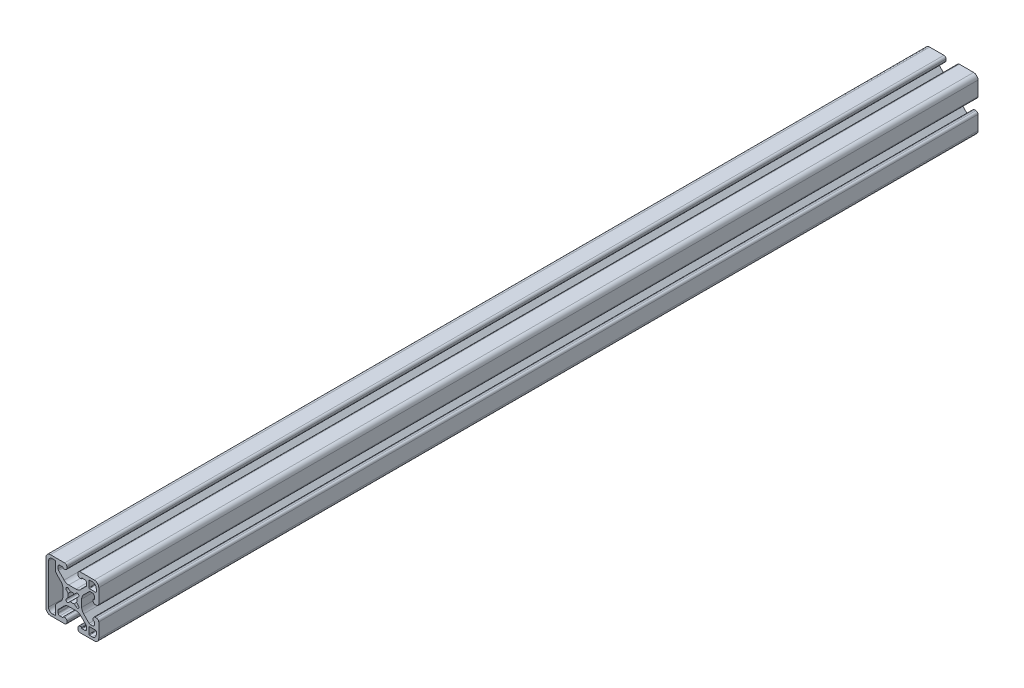
from build123d import *

# Parameters (mm, degrees)
BOSS_EXTRUDE1_DEPTH = 635


with BuildPart() as part:
    # Sketch1 → Boss-Extrude1 (new body)
    with BuildSketch(Plane(origin=(0, 0, -533.4), x_dir=(-1, 0, 0), z_dir=(0, 0, -1))):
        with BuildLine():
            Line((19.05, -15.875), (19.05, 15.875))
            ThreePointArc((19.05, 15.875), (18.12006403, 18.12006403), (15.875, 19.05))
            Line((15.875, 19.05), (5.579502658, 19.05))
            ThreePointArc((5.579502658, 19.05), (4.485554656, 18.608016318), (4.005661984, 17.530159727))
            Line((4.005661984, 17.530159727), (3.973730432, 16.615759727))
            ThreePointArc((3.973730432, 16.615759727), (4.414754789, 15.466851998), (5.547571106, 14.986))
            Line((5.547571106, 14.986), (6.268347165, 14.986))
            ThreePointArc((6.268347165, 14.986), (6.533012004, 15.092931536), (6.64911507, 15.353703292))
            Line((6.64911507, 15.353703292), (6.652704695, 15.456496708))
            ThreePointArc((6.652704695, 15.456496708), (6.768807761, 15.717268464), (7.0334726, 15.8242))
            Line((7.0334726, 15.8242), (9.017, 15.8242))
            ThreePointArc((9.017, 15.8242), (9.915025612, 15.452225612), (10.287, 14.5542))
            Line((10.287, 14.5542), (10.287, 12.968317424))
            ThreePointArc((10.287, 12.968317424), (10.190327006, 12.482309465), (9.915025612, 12.070291812))
            Line((9.915025612, 12.070291812), (5.966918011, 8.122184211))
            ThreePointArc((5.966918011, 8.122184211), (4.425971988, 7.092556996), (2.608302221, 6.731))
            Line((2.608302221, 6.731), (-2.608302221, 6.731))
            ThreePointArc((-2.608302221, 6.731), (-4.425971988, 7.092556996), (-5.966918011, 8.122184211))
            Line((-5.966918011, 8.122184211), (-9.915025612, 12.070291812))
            ThreePointArc((-9.915025612, 12.070291812), (-10.190327006, 12.482309465), (-10.287, 12.968317424))
            Line((-10.287, 12.968317424), (-10.287, 14.5542))
            ThreePointArc((-10.287, 14.5542), (-9.915025612, 15.452225612), (-9.017, 15.8242))
            Line((-9.017, 15.8242), (-7.0334726, 15.8242))
            ThreePointArc((-7.0334726, 15.8242), (-6.768807761, 15.717268464), (-6.652704695, 15.456496708))
            Line((-6.652704695, 15.456496708), (-6.64911507, 15.353703292))
            ThreePointArc((-6.64911507, 15.353703292), (-6.533012004, 15.092931536), (-6.268347165, 14.986))
            Line((-6.268347165, 14.986), (-5.547571106, 14.986))
            ThreePointArc((-5.547571106, 14.986), (-4.414754789, 15.466851998), (-3.973730432, 16.615759727))
            Line((-3.973730432, 16.615759727), (-4.005661984, 17.530159727))
            ThreePointArc((-4.005661984, 17.530159727), (-4.485554656, 18.608016318), (-5.579502658, 19.05))
            Line((-5.579502658, 19.05), (-15.875, 19.05))
            ThreePointArc((-15.875, 19.05), (-18.12006403, 18.12006403), (-19.05, 15.875))
            Line((-19.05, 15.875), (-19.05, 5.579502658))
            ThreePointArc((-19.05, 5.579502658), (-18.608016318, 4.485554656), (-17.530159727, 4.005661984))
            Line((-17.530159727, 4.005661984), (-16.615759727, 3.973730432))
            ThreePointArc((-16.615759727, 3.973730432), (-15.466851998, 4.414754789), (-14.986, 5.547571106))
            Line((-14.986, 5.547571106), (-14.986, 6.268347165))
            ThreePointArc((-14.986, 6.268347165), (-15.092931536, 6.533012004), (-15.353703292, 6.64911507))
            Line((-15.353703292, 6.64911507), (-15.456496708, 6.652704695))
            ThreePointArc((-15.456496708, 6.652704695), (-15.717268464, 6.768807761), (-15.8242, 7.0334726))
            Line((-15.8242, 7.0334726), (-15.8242, 9.017))
            ThreePointArc((-15.8242, 9.017), (-15.452225612, 9.915025612), (-14.5542, 10.287))
            Line((-14.5542, 10.287), (-12.968317424, 10.287))
            ThreePointArc((-12.968317424, 10.287), (-12.482309465, 10.190327006), (-12.070291812, 9.915025612))
            Line((-12.070291812, 9.915025612), (-8.122184211, 5.966918011))
            ThreePointArc((-8.122184211, 5.966918011), (-7.092556996, 4.425971988), (-6.731, 2.608302221))
            Line((-6.731, 2.608302221), (-6.731, -2.608302221))
            ThreePointArc((-6.731, -2.608302221), (-7.092556996, -4.425971988), (-8.122184211, -5.966918011))
            Line((-8.122184211, -5.966918011), (-12.070291812, -9.915025612))
            ThreePointArc((-12.070291812, -9.915025612), (-12.482309465, -10.190327006), (-12.968317424, -10.287))
            Line((-12.968317424, -10.287), (-14.5542, -10.287))
            ThreePointArc((-14.5542, -10.287), (-15.452225612, -9.915025612), (-15.8242, -9.017))
            Line((-15.8242, -9.017), (-15.8242, -7.0334726))
            ThreePointArc((-15.8242, -7.0334726), (-15.717268464, -6.768807761), (-15.456496708, -6.652704695))
            Line((-15.456496708, -6.652704695), (-15.353703292, -6.64911507))
            ThreePointArc((-15.353703292, -6.64911507), (-15.092931536, -6.533012004), (-14.986, -6.268347165))
            Line((-14.986, -6.268347165), (-14.986, -5.547571106))
            ThreePointArc((-14.986, -5.547571106), (-15.466851998, -4.414754789), (-16.615759727, -3.973730432))
            Line((-16.615759727, -3.973730432), (-17.530159727, -4.005661984))
            ThreePointArc((-17.530159727, -4.005661984), (-18.608016318, -4.485554656), (-19.05, -5.579502658))
            Line((-19.05, -5.579502658), (-19.05, -15.875))
            ThreePointArc((-19.05, -15.875), (-18.12006403, -18.12006403), (-15.875, -19.05))
            Line((-15.875, -19.05), (-5.579502658, -19.05))
            ThreePointArc((-5.579502658, -19.05), (-4.485554656, -18.608016318), (-4.005661984, -17.530159727))
            Line((-4.005661984, -17.530159727), (-3.973730432, -16.615759727))
            ThreePointArc((-3.973730432, -16.615759727), (-4.414754789, -15.466851998), (-5.547571106, -14.986))
            Line((-5.547571106, -14.986), (-6.268347165, -14.986))
            ThreePointArc((-6.268347165, -14.986), (-6.533012004, -15.092931536), (-6.64911507, -15.353703292))
            Line((-6.64911507, -15.353703292), (-6.652704695, -15.456496708))
            ThreePointArc((-6.652704695, -15.456496708), (-6.768807761, -15.717268464), (-7.0334726, -15.8242))
            Line((-7.0334726, -15.8242), (-9.017, -15.8242))
            ThreePointArc((-9.017, -15.8242), (-9.915025612, -15.452225612), (-10.287, -14.5542))
            Line((-10.287, -14.5542), (-10.287, -12.968317424))
            ThreePointArc((-10.287, -12.968317424), (-10.190327006, -12.482309465), (-9.915025612, -12.070291812))
            Line((-9.915025612, -12.070291812), (-5.966918011, -8.122184211))
            ThreePointArc((-5.966918011, -8.122184211), (-4.425971988, -7.092556996), (-2.608302221, -6.731))
            Line((-2.608302221, -6.731), (2.608302221, -6.731))
            ThreePointArc((2.608302221, -6.731), (4.425971988, -7.092556996), (5.966918011, -8.122184211))
            Line((5.966918011, -8.122184211), (9.915025612, -12.070291812))
            ThreePointArc((9.915025612, -12.070291812), (10.190327006, -12.482309465), (10.287, -12.968317424))
            Line((10.287, -12.968317424), (10.287, -14.5542))
            ThreePointArc((10.287, -14.5542), (9.915025612, -15.452225612), (9.017, -15.8242))
            Line((9.017, -15.8242), (7.0334726, -15.8242))
            ThreePointArc((7.0334726, -15.8242), (6.768807761, -15.717268464), (6.652704695, -15.456496708))
            Line((6.652704695, -15.456496708), (6.64911507, -15.353703292))
            ThreePointArc((6.64911507, -15.353703292), (6.533012004, -15.092931536), (6.268347165, -14.986))
            Line((6.268347165, -14.986), (5.547571106, -14.986))
            ThreePointArc((5.547571106, -14.986), (4.414754789, -15.466851998), (3.973730432, -16.615759727))
            Line((3.973730432, -16.615759727), (4.005661984, -17.530159727))
            ThreePointArc((4.005661984, -17.530159727), (4.485554656, -18.608016318), (5.579502658, -19.05))
            Line((5.579502658, -19.05), (15.875, -19.05))
            ThreePointArc((15.875, -19.05), (18.12006403, -18.12006403), (19.05, -15.875))
        make_face()
        with BuildLine():
            Line((17.246274531, 14.452274531), (17.246274531, -14.452265069))
            ThreePointArc((17.246274531, -14.452265069), (16.427930878, -16.427921416), (14.452274531, -17.246265069))
            Line((14.452274531, -17.246265069), (12.580319931, -17.246265069))
            ThreePointArc((12.580319931, -17.246265069), (12.310912247, -17.134672753), (12.199319931, -16.865265069))
            Line((12.199319931, -16.865265069), (12.199319931, -11.359181791))
            ThreePointArc((12.199319931, -11.359181791), (11.957637447, -10.144161894), (11.269383961, -9.114117761))
            Line((11.269383961, -9.114117761), (8.256910542, -6.101644342))
            ThreePointArc((8.256910542, -6.101644342), (7.227283327, -4.560698319), (6.865726331, -2.743028552))
            Line((6.865726331, -2.743028552), (6.865726331, 2.743028552))
            ThreePointArc((6.865726331, 2.743028552), (7.227283327, 4.560698319), (8.256910542, 6.101644342))
            Line((8.256910542, 6.101644342), (11.269383961, 9.114117761))
            ThreePointArc((11.269383961, 9.114117761), (11.957637447, 10.144161894), (12.199319931, 11.359181791))
            Line((12.199319931, 11.359181791), (12.199319931, 16.865274531))
            ThreePointArc((12.199319931, 16.865274531), (12.310912247, 17.134682215), (12.580319931, 17.246274531))
            Line((12.580319931, 17.246274531), (14.452274531, 17.246274531))
            ThreePointArc((14.452274531, 17.246274531), (16.427930878, 16.427930878), (17.246274531, 14.452274531))
        make_face(mode=Mode.SUBTRACT)
        with BuildLine():
            Line((3.017877069, -1.401430967), (4.343300944, -2.726854842))
            ThreePointArc((4.343300944, -2.726854842), (4.343300944, -4.343300944), (2.726854842, -4.343300944))
            Line((2.726854842, -4.343300944), (1.401430967, -3.017877069))
            ThreePointArc((1.401430967, -3.017877069), (0, -3.3274), (-1.401430967, -3.017877069))
            Line((-1.401430967, -3.017877069), (-2.726854842, -4.343300944))
            ThreePointArc((-2.726854842, -4.343300944), (-4.343300944, -4.343300944), (-4.343300944, -2.726854842))
            Line((-4.343300944, -2.726854842), (-3.017877069, -1.401430967))
            ThreePointArc((-3.017877069, -1.401430967), (-3.3274, 0), (-3.017877069, 1.401430967))
            Line((-3.017877069, 1.401430967), (-4.343300944, 2.726854842))
            ThreePointArc((-4.343300944, 2.726854842), (-4.343300944, 4.343300944), (-2.726854842, 4.343300944))
            Line((-2.726854842, 4.343300944), (-1.401430967, 3.017877069))
            ThreePointArc((-1.401430967, 3.017877069), (0, 3.3274), (1.401430967, 3.017877069))
            Line((1.401430967, 3.017877069), (2.726854842, 4.343300944))
            ThreePointArc((2.726854842, 4.343300944), (4.343300944, 4.343300944), (4.343300944, 2.726854842))
            Line((4.343300944, 2.726854842), (3.017877069, 1.401430967))
            ThreePointArc((3.017877069, 1.401430967), (3.3274, 0), (3.017877069, -1.401430967))
        make_face(mode=Mode.SUBTRACT)
        with BuildLine():
            Line((-11.8618, 16.8656), (-11.8618, 12.2428))
            ThreePointArc((-11.8618, 12.2428), (-11.973392316, 11.973392316), (-12.2428, 11.8618))
            Line((-12.2428, 11.8618), (-16.8656, 11.8618))
            ThreePointArc((-16.8656, 11.8618), (-17.135007684, 11.973392316), (-17.2466, 12.2428))
            Line((-17.2466, 12.2428), (-17.2466, 14.4526))
            ThreePointArc((-17.2466, 14.4526), (-16.428256347, 16.428256347), (-14.4526, 17.2466))
            Line((-14.4526, 17.2466), (-12.2428, 17.2466))
            ThreePointArc((-12.2428, 17.2466), (-11.973392316, 17.135007684), (-11.8618, 16.8656))
        make_face(mode=Mode.SUBTRACT)
        with BuildLine():
            Line((-11.8618, -12.2428), (-11.8618, -16.8656))
            ThreePointArc((-11.8618, -16.8656), (-11.973392316, -17.135007684), (-12.2428, -17.2466))
            Line((-12.2428, -17.2466), (-14.4526, -17.2466))
            ThreePointArc((-14.4526, -17.2466), (-16.428256347, -16.428256347), (-17.2466, -14.4526))
            Line((-17.2466, -14.4526), (-17.2466, -12.2428))
            ThreePointArc((-17.2466, -12.2428), (-17.135007684, -11.973392316), (-16.8656, -11.8618))
            Line((-16.8656, -11.8618), (-12.2428, -11.8618))
            ThreePointArc((-12.2428, -11.8618), (-11.973392316, -11.973392316), (-11.8618, -12.2428))
        make_face(mode=Mode.SUBTRACT)
    extrude(amount=-BOSS_EXTRUDE1_DEPTH)


solid = part.part
